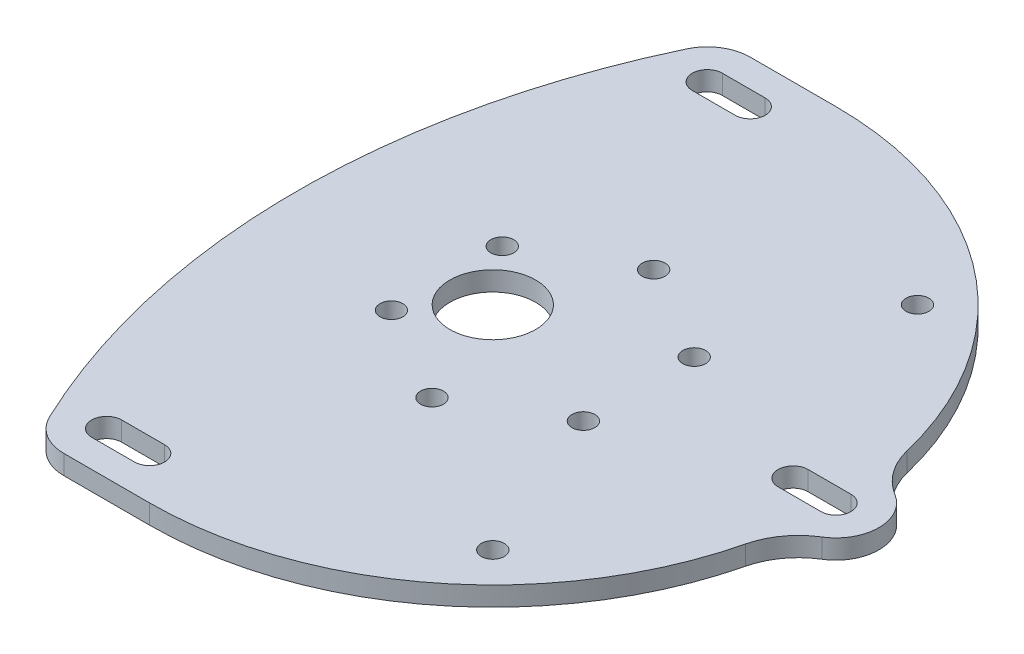
from build123d import *

# Parameters (mm, degrees)
ESQUISSE2_R                  = 6
ESQUISSE2_R_2                = 1.6
BOSS_EXTRU_1_DEPTH           = 2.7
ESQUISSE3_R                  = 1.6
ENL_V_MAT_EXTRU_1_DEPTH      = 69.646121522
R_P_TITION_CIRCULAIRE1_COUNT = 6


with BuildPart() as part:
    # Esquisse2 → Boss.-Extru.1 (new body)
    with BuildSketch(Plane(origin=(0, 0, 0), x_dir=(1, 0, 0), z_dir=(0, 1, 0))):
        with BuildLine():
            Line((-17, -48), (-5, -48))
            ThreePointArc((-5, -48), (24.685348475, -37.719757236), (41.655172414, -11.28250358))
            ThreePointArc((41.655172414, -11.28250358), (43.286450296, -7.752943214), (46.140625, -5.112384435))
            ThreePointArc((46.140625, -5.112384435), (49, 0), (46.140625, 5.112384435))
            ThreePointArc((46.140625, 5.112384435), (43.286450296, 7.752943214), (41.655172414, 11.28250358))
            ThreePointArc((41.655172414, 11.28250358), (24.685348475, 37.719757236), (-5, 48))
            Line((-5, 48), (-17, 48))
            ThreePointArc((-17, 48), (-20.20664932, 47.071232606), (-22.420554861, 44.572466714))
            ThreePointArc((-22.420554861, 44.572466714), (-32.460451204, 0), (-22.420554861, -44.572466714))
            ThreePointArc((-22.420554861, -44.572466714), (-20.20664932, -47.071232606), (-17, -48))
        make_face()
        with Locations((-5, 0)):
            Circle(ESQUISSE2_R, mode=Mode.SUBTRACT)
        with Locations((24.69848481, 29.69848481)):
            Circle(ESQUISSE2_R_2, mode=Mode.SUBTRACT)
        with Locations((24.69848481, -29.69848481)):
            Circle(ESQUISSE2_R_2, mode=Mode.SUBTRACT)
        with BuildLine():
            Line((-17, 44.1), (-11, 44.1))
            ThreePointArc((-11, 44.1), (-8.9, 42), (-11, 39.9))
            Line((-11, 39.9), (-17, 39.9))
            ThreePointArc((-17, 39.9), (-19.1, 42), (-17, 44.1))
        make_face(mode=Mode.SUBTRACT)
        with BuildLine():
            Line((43, 2.1), (37, 2.1))
            ThreePointArc((37, 2.1), (34.9, 0), (37, -2.1))
            Line((37, -2.1), (43, -2.1))
            ThreePointArc((43, -2.1), (45.1, 0), (43, 2.1))
        make_face(mode=Mode.SUBTRACT)
        with BuildLine():
            Line((-17, -44.1), (-11, -44.1))
            ThreePointArc((-11, -44.1), (-8.9, -42), (-11, -39.9))
            Line((-11, -39.9), (-17, -39.9))
            ThreePointArc((-17, -39.9), (-19.1, -42), (-17, -44.1))
        make_face(mode=Mode.SUBTRACT)
    extrude(amount=BOSS_EXTRU_1_DEPTH)

    # Esquisse3 → Enlèv. mat.-Extru.1 (cut, through all)
    with BuildSketch(Plane(origin=(0, 0, 0), x_dir=(1, 0, 0), z_dir=(0, 1, 0))):
        with Locations((2, 15.5)):
            Circle(ESQUISSE3_R)
    enl_v_mat_extru_1 = extrude(amount=ENL_V_MAT_EXTRU_1_DEPTH, mode=Mode.SUBTRACT)

    # Répétition circulaire1: Enlèv. mat.-Extru.1 ×6 about axis
    r_p_tition_circulaire1_axis = Axis((2, 0, 0), (0, 1, 0))
    for i in range(1, R_P_TITION_CIRCULAIRE1_COUNT):
        add(enl_v_mat_extru_1.rotate(r_p_tition_circulaire1_axis, i * 360 / R_P_TITION_CIRCULAIRE1_COUNT), mode=Mode.SUBTRACT)


solid = part.part
